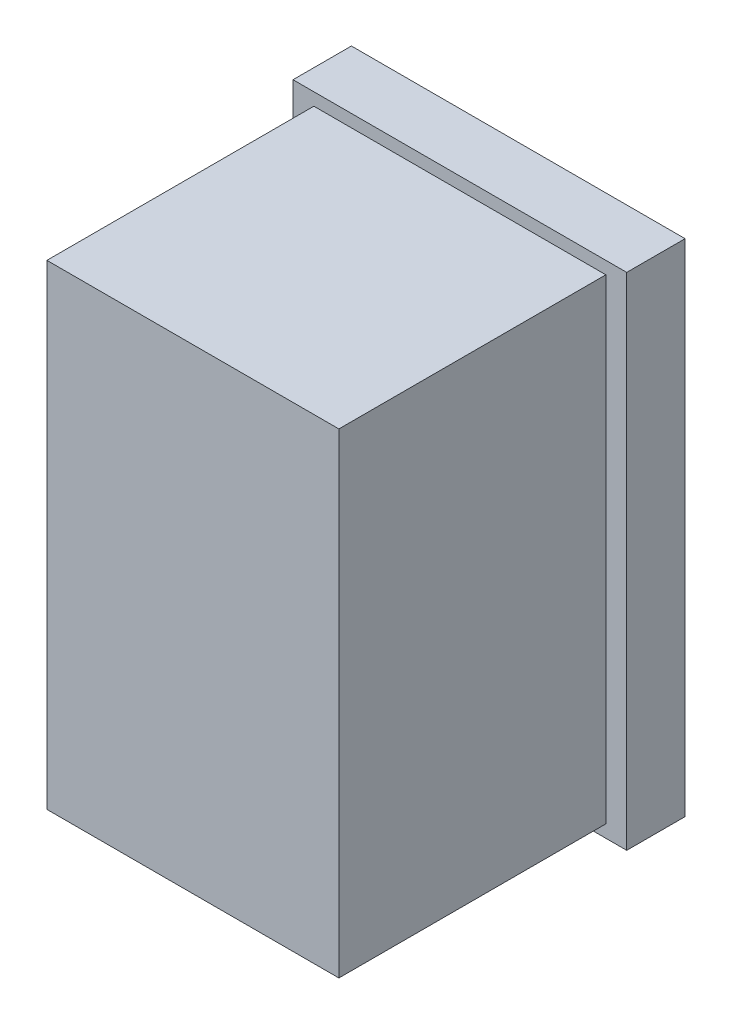
from build123d import *

# Parameters (mm, degrees)
SKETCH1_W           = 8.89
SKETCH1_H           = 14.478
BOSS_EXTRUDE1_DEPTH = 8.128
SKETCH2_W           = 10.16
SKETCH2_H           = 15.24
BOSS_EXTRUDE2_DEPTH = 1.778


with BuildPart() as part:
    # Sketch1 → Boss-Extrude1 (new body)
    with BuildSketch(Plane.XY):
        Rectangle(SKETCH1_W, SKETCH1_H)
    extrude(amount=BOSS_EXTRUDE1_DEPTH)

    # Sketch2 → Boss-Extrude2 (add)
    with BuildSketch(Plane(origin=(0, 0, 0), x_dir=(-1, 0, 0), z_dir=(0, 0, -1))):
        Rectangle(SKETCH2_W, SKETCH2_H)
    extrude(amount=BOSS_EXTRUDE2_DEPTH)


solid = part.part
